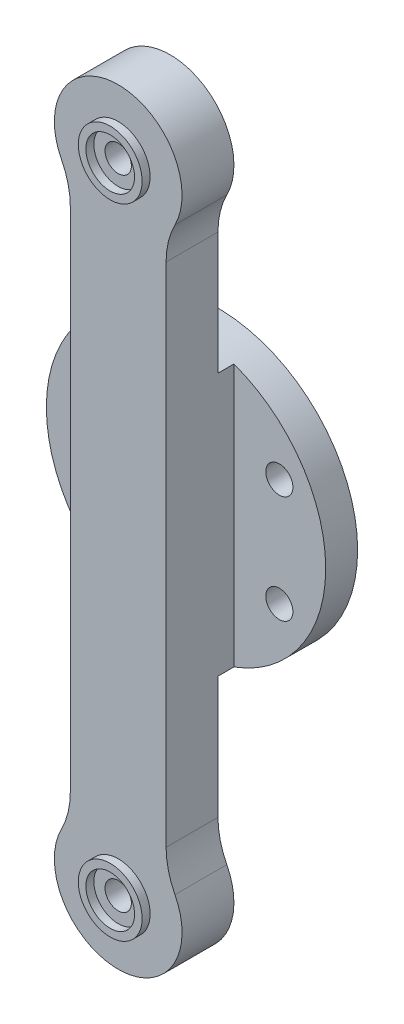
from build123d import *

# Parameters (mm, degrees)
SKETCH_1_W                   = 17.5
SKETCH_1_H                   = 4
EXTRUDE_1_DEPTH              = 2
EXTRUDE_2_DEPTH              = 6.5
SKETCH_4_W                   = 4
SKETCH_4_H                   = 1
SKETCH_5_W                   = 4
SKETCH_5_H                   = 1
HOLE_WIZARD_3_4_3_4_1_D      = 3.4
HOLE_WIZARD_3_4_3_4_1_DEPTH  = 13.5
HOLE_WIZARD_M3_1_D           = 3.3
HOLE_WIZARD_M3_1_DEPTH       = 13.5
HOLE_WIZARD_M3_1_CBORE_D     = 6.1
HOLE_WIZARD_M3_1_CBORE_DEPTH = 1
FILLET_1_R                   = 10


with BuildPart() as part:
    # 草图1 → 旋转1 (revolve)
    with BuildSketch(Plane(origin=(0, 0, 0), x_dir=(1, 0, 0), z_dir=(0, 1, 0))):
        with Locations((8.75, 2)):
            Rectangle(SKETCH_1_W, SKETCH_1_H)
    revolve(axis=Axis((0, 0, -4), (0, 0, 1)))

    # 草图2 → 凸台-拉伸1 (add)
    with BuildSketch(Plane.XY):
        with BuildLine():
            Line((6, 16.439282223), (6, -16.439282223))
            ThreePointArc((6, -16.439282223), (0, -17.5), (-6, -16.439282223))
            Line((-6, -16.439282223), (-6, 16.439282223))
            ThreePointArc((-6, 16.439282223), (0, 17.5), (6, 16.439282223))
        make_face()
    extrude(amount=EXTRUDE_1_DEPTH)

    # 草图3 → 凸台-拉伸2 (add)
    with BuildSketch(Plane.XY.offset(2)):
        with BuildLine():
            Line((-6, -34.708497378), (-6, 34.708497378))
            ThreePointArc((-6, 34.708497378), (0, 48), (6, 34.708497378))
            Line((6, 34.708497378), (6, -34.708497378))
            ThreePointArc((6, -34.708497378), (0, -48), (-6, -34.708497378))
        make_face()
    extrude(amount=EXTRUDE_2_DEPTH)

    # 草图4 → 旋转2 (revolve)
    with BuildSketch(Plane.XZ.offset(40), mode=Mode.PRIVATE) as revolve_2_sk:
        with Locations((2, 9)):
            Rectangle(SKETCH_4_W, SKETCH_4_H)
    revolve(revolve_2_sk.sketch.rotate(Axis((0, -40, 9.5), (0, 0, -1)), 180), axis=Axis((0, -40, 9.5), (0, 0, -1)))

    # 草图5 → 旋转3 (revolve)
    with BuildSketch(Plane.XZ.offset(-40), mode=Mode.PRIVATE) as revolve_3_sk:
        with Locations((2, 9)):
            Rectangle(SKETCH_5_W, SKETCH_5_H)
    revolve(revolve_3_sk.sketch.rotate(Axis((0, 40, 9.5), (0, 0, -1)), 180), axis=Axis((0, 40, 9.5), (0, 0, -1)))

    # Ø3.4 (3.4) 直径孔1
    with Locations(Plane(origin=(0, 0, -4), x_dir=(-1, 0, 0), z_dir=(0, 0, -1))):
        with Locations((11.691342951, 6.75), (11.691342951, -6.75), (-11.691342951, -6.75), (-11.691342951, 6.75)):
            Hole(HOLE_WIZARD_3_4_3_4_1_D / 2, depth=HOLE_WIZARD_3_4_3_4_1_DEPTH)

    # M3 六角头机械螺钉的柱形沉头孔1
    with Locations(Plane.XY.offset(9.5)):
        with Locations((0, -40), (0, 40)):
            CounterBoreHole(HOLE_WIZARD_M3_1_D / 2, HOLE_WIZARD_M3_1_CBORE_D / 2, HOLE_WIZARD_M3_1_CBORE_DEPTH, depth=HOLE_WIZARD_M3_1_DEPTH)

    # 圆角1
    fillet_1_edges = [part.edges().sort_by_distance(p)[0] for p in [
        (-6, -34.708497378, 5.25),
        (6, -34.708497378, 5.25),
        (6, 34.708497378, 5.25),
        (-6, 34.708497378, 5.25),
    ]]
    fillet(fillet_1_edges, radius=FILLET_1_R)


solid = part.part
